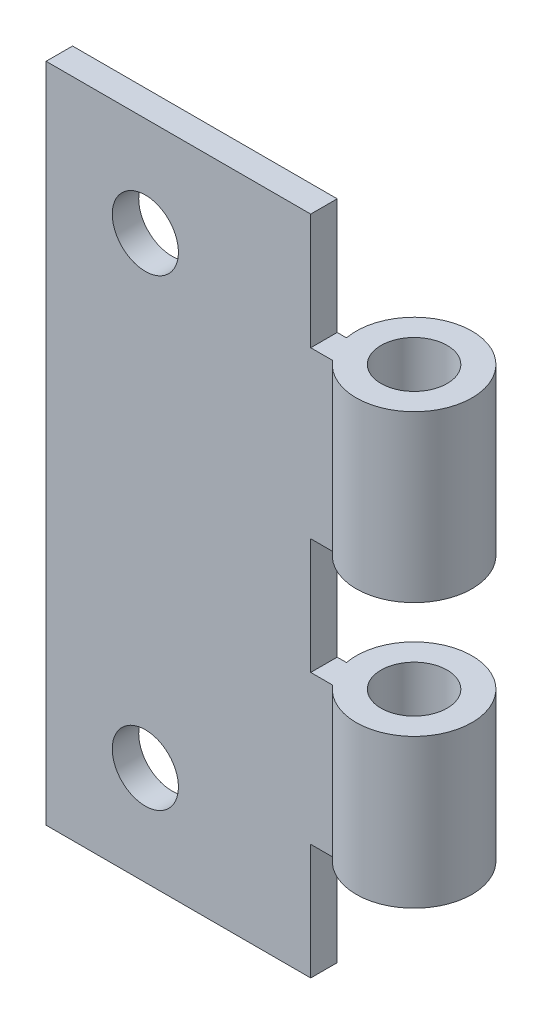
from build123d import *

# Parameters (mm, degrees)
BOSS_EXTRUDE1_DEPTH = 50.8
SKETCH2_R           = 2.54
CUT_EXTRUDE1_DEPTH  = 50.8
CUT_EXTRUDE2_DEPTH  = 8.89
CUT_EXTRUDE3_START  = 20.32
CUT_EXTRUDE3_DEPTH  = 8.89
SKETCH3_R           = 2.54
CUT_EXTRUDE4_DEPTH  = 60.369104181
CUT_EXTRUDE5_START  = 41.91
CUT_EXTRUDE5_DEPTH  = 8.89


with BuildPart() as part:
    # Sketch1 → Boss-Extrude1 (new body)
    with BuildSketch(Plane(origin=(0, 0, 0), x_dir=(1, 0, 0), z_dir=(0, 1, 0))):
        with BuildLine():
            Line((0, 0), (21.995191819, 0))
            ThreePointArc((21.995191819, 0), (29.416855136, 4.760891662), (21.032326163, 2.032))
            Line((21.032326163, 2.032), (0, 2.032))
            Line((0, 2.032), (0, 0))
        make_face()
    extrude(amount=BOSS_EXTRUDE1_DEPTH)

    # Sketch2 → Cut-Extrude1 (cut)
    with BuildSketch(Plane(origin=(0, 0, -2.032), x_dir=(-1, 0, 0), z_dir=(0, 0, -1))):
        with Locations((-7.62, 43.18)):
            Circle(SKETCH2_R)
        with Locations((-7.62, 7.62)):
            Circle(SKETCH2_R)
    extrude(amount=-CUT_EXTRUDE1_DEPTH, mode=Mode.SUBTRACT)

    # Sketch1<3> → Cut-Extrude2 (cut)
    with BuildSketch(Plane(origin=(0, 0, 0), x_dir=(1, 0, 0), z_dir=(0, 1, 0))):
        with BuildLine():
            Line((21.032326163, 2.032), (20.32, 2.032))
            Line((20.32, 2.032), (20.32, 0))
            Line((20.32, 0), (21.995191819, 0))
            ThreePointArc((21.995191819, 0), (29.416855136, 4.760891662), (21.032326163, 2.032))
        make_face()
    extrude(amount=CUT_EXTRUDE2_DEPTH, mode=Mode.SUBTRACT)

    # Sketch1<5> → Cut-Extrude3 (cut)
    with BuildSketch(Plane(origin=(0, 0, 0), x_dir=(1, 0, 0), z_dir=(0, 1, 0)).offset(CUT_EXTRUDE3_START)):
        with BuildLine():
            Line((21.032326163, 2.032), (20.32, 2.032))
            Line((20.32, 2.032), (20.32, 0))
            Line((20.32, 0), (21.995191819, 0))
            ThreePointArc((21.995191819, 0), (29.416855136, 4.760891662), (21.032326163, 2.032))
        make_face()
    extrude(amount=CUT_EXTRUDE3_DEPTH, mode=Mode.SUBTRACT)

    # Sketch3 → Cut-Extrude4 (cut, through all)
    with BuildSketch(Plane(origin=(0, 50.8, 0), x_dir=(1, 0, 0), z_dir=(0, 1, 0))):
        with Locations((25.4, 2.8575)):
            Circle(SKETCH3_R)
    extrude(amount=-CUT_EXTRUDE4_DEPTH, mode=Mode.SUBTRACT)

    # Sketch1<6> → Cut-Extrude5 (cut)
    with BuildSketch(Plane(origin=(0, 0, 0), x_dir=(1, 0, 0), z_dir=(0, 1, 0)).offset(CUT_EXTRUDE5_START)):
        with BuildLine():
            Line((21.032326163, 2.032), (20.32, 2.032))
            Line((20.32, 2.032), (20.32, 0))
            Line((20.32, 0), (21.995191819, 0))
            ThreePointArc((21.995191819, 0), (29.416855136, 4.760891662), (21.032326163, 2.032))
        make_face()
    extrude(amount=CUT_EXTRUDE5_DEPTH, mode=Mode.SUBTRACT)


solid = part.part
